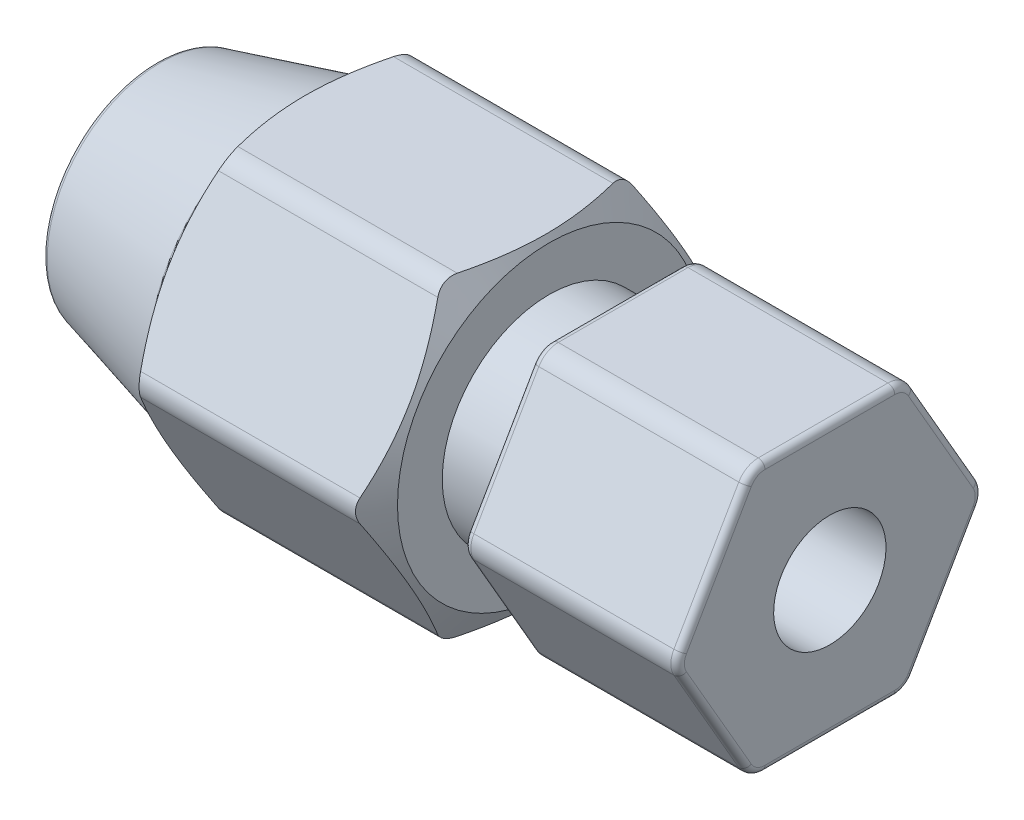
from build123d import *

# Parameters (mm, degrees)
SKETCH_2_R          = 12.5
CUT_EXTRUDE_1_DEPTH = 52.435604664
FILLET_1_R          = 1
SKETCH_3_R          = 12.5
CUT_EXTRUDE_2_DEPTH = 52.435604664
FILLET_2_R          = 0.3
FILLET_3_R          = 1
FILLET_4_R          = 0.15


with BuildPart() as part:
    # Эскиз1 → Повернуть1 (revolve)
    with BuildSketch(Plane.XY):
        Polygon((-30, 36.723884975), (0, 36.723884975), (0, 38.973884975), (0, 40), (0, 46.723884975), (-9.5, 46.723884975), (-9.5, 38.973884975), (-12.5, 38.973884975), (-12.5, 40.965554725), (-15.824573519, 46.723884975), (-20.175426481, 46.723884975), (-23.5, 40.965554725), (-30, 39.223884975), (-30, 38.473884975), (-27.5, 38.473884975), (-27.5, 37.692606633), (-30, 37.473884975), align=None)
    revolve(axis=Axis((0, 34.223884975, 0), (-1, 0, 0)))

    # Эскиз2 → Вырез-Вытянуть1 (cut, through all)
    with BuildSketch(Plane(origin=(-12.5, 0, 0), x_dir=(0, 0, -1), z_dir=(1, 0, 0))):
        with Locations(Location((0, 34.223884975, 0), (0, 0, 90))):
            Circle(SKETCH_2_R)
        Polygon((3.464101615, 28.223884975), (6.92820323, 34.223884975), (3.464101615, 40.223884975), (-3.464101615, 40.223884975), (-6.92820323, 34.223884975), (-3.464101615, 28.223884975), align=None, mode=Mode.SUBTRACT)
    extrude(amount=CUT_EXTRUDE_1_DEPTH, mode=Mode.SUBTRACT)

    # Скругление1
    fillet_1_edges = [part.edges().sort_by_distance(p)[0] for p in [
        (-4.75, 28.223884975, -3.464101615),
        (-4.75, 34.223884975, -6.92820323),
        (-4.75, 40.223884975, -3.464101615),
        (-4.75, 40.223884975, 3.464101615),
        (-4.75, 34.223884975, 6.92820323),
        (-4.75, 28.223884975, 3.464101615),
    ]]
    fillet(fillet_1_edges, radius=FILLET_1_R)

    # Эскиз3 → Вырез-Вытянуть2 (cut, through all)
    with BuildSketch(Plane(origin=(-12.5, 0, 0), x_dir=(0, 0, -1), z_dir=(1, 0, 0))):
        with Locations((0, 34.223884975)):
            Circle(SKETCH_3_R)
        Polygon((-4.041451884, 27.223884975), (4.041451884, 27.223884975), (8.082903769, 34.223884975), (4.041451884, 41.223884975), (-4.041451884, 41.223884975), (-8.082903769, 34.223884975), align=None, mode=Mode.SUBTRACT)
    extrude(amount=-CUT_EXTRUDE_2_DEPTH, mode=Mode.SUBTRACT)

    # Скругление2
    fillet_2_edges = [part.edges().sort_by_distance(p)[0] for p in [
        (-30, 31.723884975, 0),
        (-30, 30.973884975, 0),
        (-30, 29.223884975, 0),
        (-23.5, 27.482215224, 0),
        (-9.5, 29.473884975, 0),
        (0, 37.223884975, -5.196152423),
        (-9.5, 37.223884975, -5.196152423),
        (-9.5, 31.223884975, -5.196152423),
        (-9.5, 28.223884975, 0),
        (-9.5, 31.223884975, 5.196152423),
        (-9.5, 37.223884975, 5.196152423),
        (-9.5, 40.223884975, 0),
        (-9.5, 40.089910378, 3.386751346),
        (-9.5, 40.089910378, -3.386751346),
        (-9.5, 34.223884975, 6.773502692),
        (-9.5, 28.357859571, 3.386751346),
        (-9.5, 28.357859571, -3.386751346),
        (-9.5, 34.223884975, -6.773502692),
        (0, 31.223884975, -5.196152423),
        (0, 31.223884975, 5.196152423),
        (0, 28.223884975, 0),
        (0, 40.223884975, 0),
        (0, 37.223884975, 5.196152423),
        (0, 40.089910378, 3.386751346),
        (0, 40.089910378, -3.386751346),
        (0, 34.223884975, 6.773502692),
        (0, 28.357859571, 3.386751346),
        (0, 28.357859571, -3.386751346),
        (0, 34.223884975, -6.773502692),
    ]]
    fillet(fillet_2_edges, radius=FILLET_2_R)

    # Скругление3
    fillet_3_edges = [part.edges().sort_by_distance(p)[0] for p in [
        (-18, 27.223884975, 4.041451884),
        (-18, 27.223884975, -4.041451884),
        (-18, 34.223884975, -8.082903769),
        (-18, 41.223884975, -4.041451884),
        (-18, 41.223884975, 4.041451884),
        (-18, 34.223884975, 8.082903769),
    ]]
    fillet(fillet_3_edges, radius=FILLET_3_R)

    # Скругление4
    fillet_4_edges = [part.edges().sort_by_distance(p)[0] for p in [
        (-30, 29.973884975, 0),
    ]]
    fillet(fillet_4_edges, radius=FILLET_4_R)


solid = part.part
